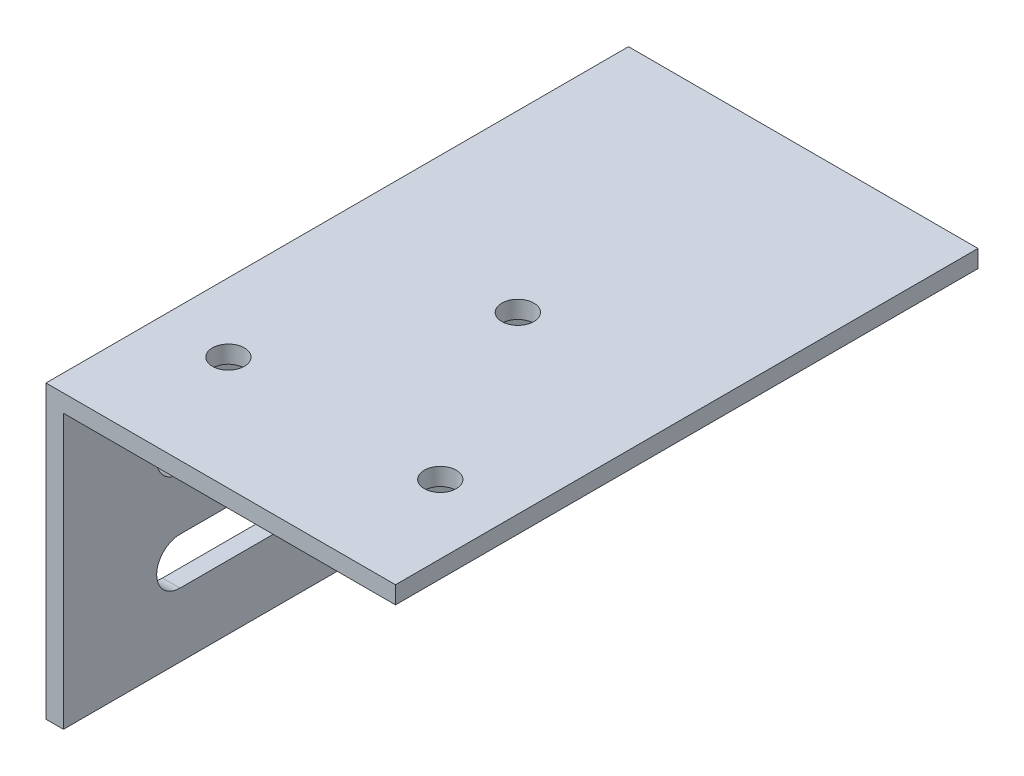
from build123d import *

# Parameters (mm, degrees)
BOSS_EXTRUDE1_DEPTH = 100
SKETCH2_R           = 2.75
CUT_EXTRUDE1_DEPTH  = 100
CUT_EXTRUDE2_DEPTH  = 100


with BuildPart() as part:
    # Sketch1 → Boss-Extrude1 (new body)
    with BuildSketch(Plane.XY):
        Polygon((0, 0), (-60, 0), (-60, -50), (-57, -50), (-57, -3), (0, -3), align=None)
    extrude(amount=BOSS_EXTRUDE1_DEPTH)

    # Sketch2 → Cut-Extrude1 (cut)
    with BuildSketch(Plane(origin=(0, 0, 0), x_dir=(1, 0, 0), z_dir=(0, 1, 0))):
        with Locations(Location((-11.813466521, -80.5, 0), (0, 0, 180))):
            Circle(SKETCH2_R)
        with Locations(Location((-48.186533479, -80.5, 0), (0, 0, 180))):
            Circle(SKETCH2_R)
        with Locations(Location((-30, -49, 0), (0, 0, 180))):
            Circle(SKETCH2_R)
    extrude(amount=-CUT_EXTRUDE1_DEPTH, mode=Mode.SUBTRACT)

    # Sketch3 → Cut-Extrude2 (cut)
    with BuildSketch(Plane(origin=(-57, 0, 0), x_dir=(0, 0, -1), z_dir=(1, 0, 0))):
        with BuildLine():
            Line((-80, -14), (-20, -14))
            ThreePointArc((-20, -14), (-16, -18), (-20, -22))
            Line((-20, -22), (-80, -22))
            ThreePointArc((-80, -22), (-84, -18), (-80, -14))
        make_face()
        with BuildLine():
            Line((-80, -39), (-20, -39))
            ThreePointArc((-20, -39), (-16, -35), (-20, -31))
            Line((-20, -31), (-80, -31))
            ThreePointArc((-80, -31), (-84, -35), (-80, -39))
        make_face()
    extrude(amount=-CUT_EXTRUDE2_DEPTH, mode=Mode.SUBTRACT)


solid = part.part
